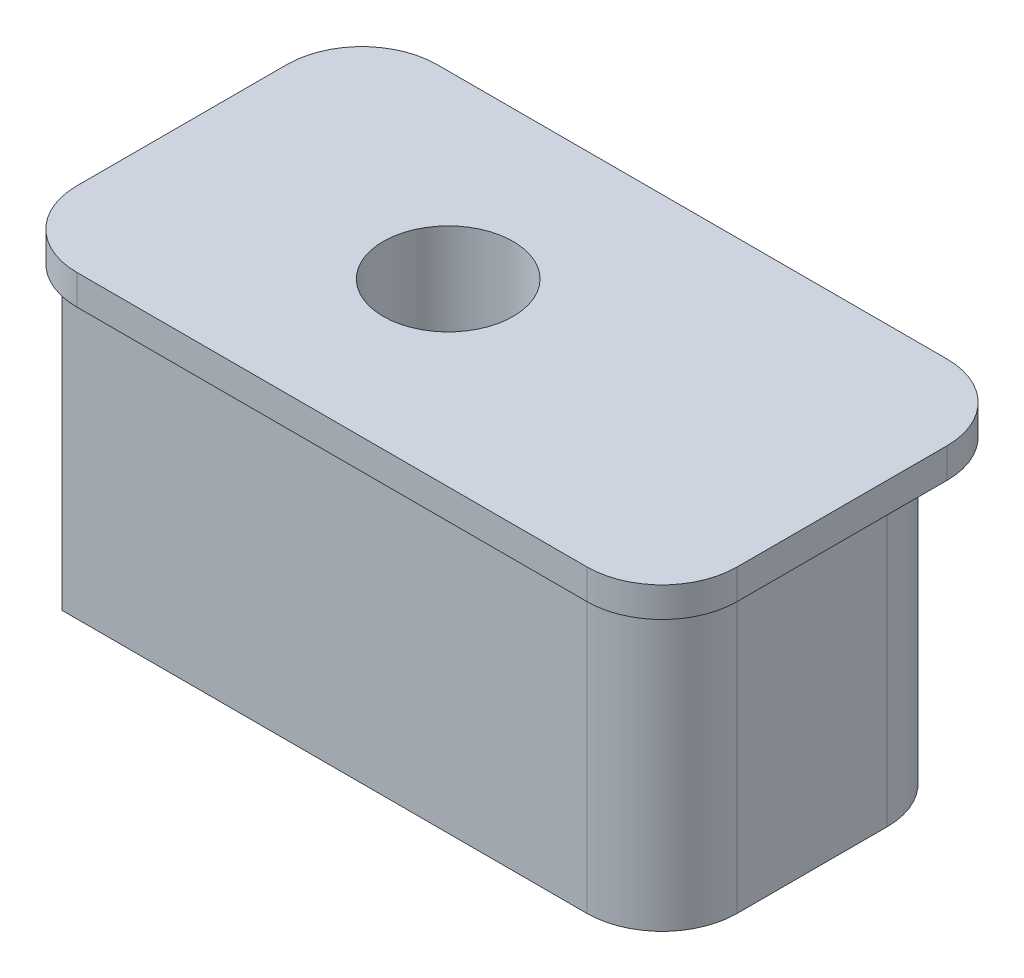
from build123d import *

# Parameters (mm, degrees)
SKETCH1_W           = 25.4
SKETCH1_H           = 12.7
BOSS_EXTRUDE1_DEPTH = 12.7
FILLET1_R           = 3.175
SKETCH2_R           = 2.75
CUT_EXTRUDE1_DEPTH  = 32.108519733
BOSS_EXTRUDE2_START = 1.27
SKETCH3_W           = 27.94
SKETCH3_H           = 15.24
SKETCH3_R           = 2.75
BOSS_EXTRUDE2_DEPTH = 1.27
FILLET2_R           = 3.175


with BuildPart() as part:
    # Sketch1 → Boss-Extrude1 (new body)
    with BuildSketch(Plane(origin=(0, 0, 0), x_dir=(1, 0, 0), z_dir=(0, 1, 0))):
        with Locations((12.7, 6.35)):
            Rectangle(SKETCH1_W, SKETCH1_H)
    extrude(amount=BOSS_EXTRUDE1_DEPTH)

    # Fillet1
    fillet1_edges = [part.edges().sort_by_distance(p)[0] for p in [
        (25.4, 6.35, -12.7),
        (25.4, 6.35, 0),
    ]]
    fillet(fillet1_edges, radius=FILLET1_R)

    # Sketch2 → Cut-Extrude1 (cut, through all)
    with BuildSketch(Plane(origin=(0, 12.7, 0), x_dir=(1, 0, 0), z_dir=(0, 1, 0))):
        with Locations(Location((10, 6.35, 0), (0, 0, 270))):
            Circle(SKETCH2_R)
    extrude(amount=-CUT_EXTRUDE1_DEPTH, mode=Mode.SUBTRACT)

    # Sketch3 → Boss-Extrude2 (add)
    with BuildSketch(Plane(origin=(0, 12.7, 0), x_dir=(1, 0, 0), z_dir=(0, 1, 0)).offset(BOSS_EXTRUDE2_START)):
        with Locations((12.7, 6.35)):
            Rectangle(SKETCH3_W, SKETCH3_H)
        with Locations(Location((10, 6.35, 0), (0, 0, 270))):
            Circle(SKETCH3_R, mode=Mode.SUBTRACT)
    extrude(amount=-BOSS_EXTRUDE2_DEPTH)

    # Fillet2
    fillet2_edges = [part.edges().sort_by_distance(p)[0] for p in [
        (-1.27, 13.335, -13.97),
        (-1.27, 13.335, 1.27),
        (26.67, 13.335, 1.27),
        (26.67, 13.335, -13.97),
    ]]
    fillet(fillet2_edges, radius=FILLET2_R)


solid = part.part
